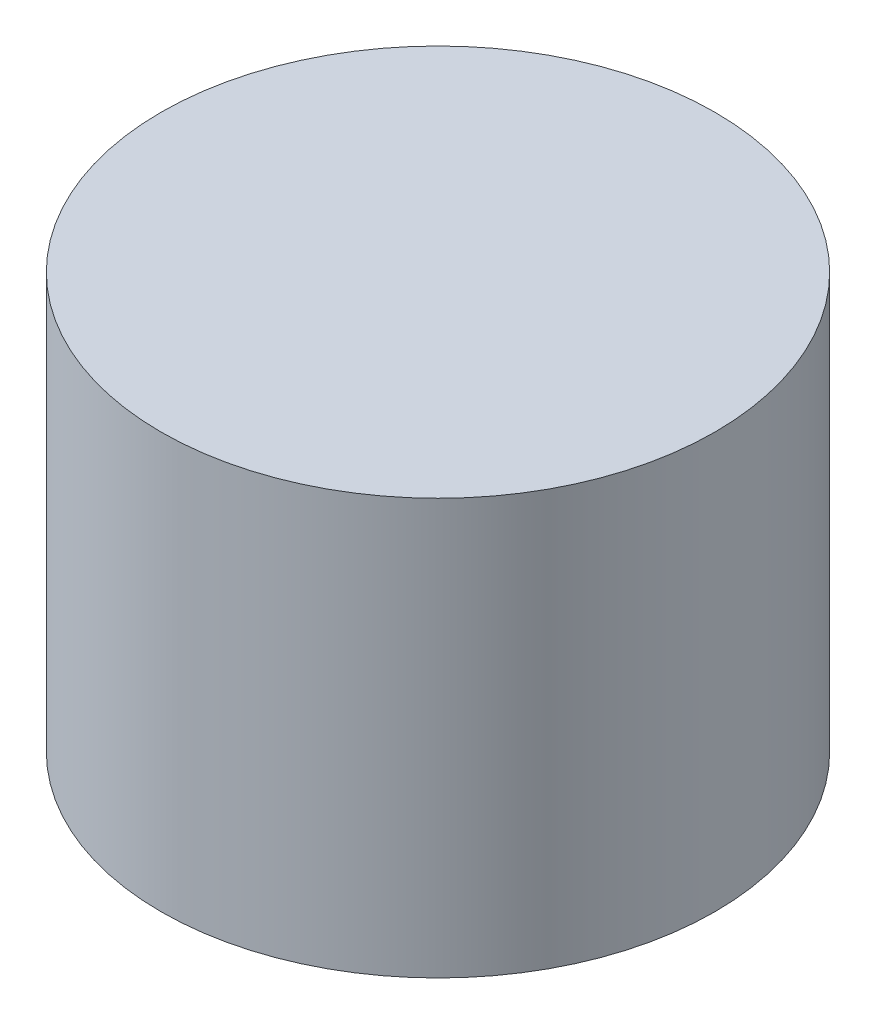
from build123d import *

# Parameters (mm, degrees)
SKETCH_2_R      = 10
EXTRUDE_1_DEPTH = 15


with BuildPart() as part:
    # 草图2 → 凸台-拉伸1 (new body)
    with BuildSketch(Plane(origin=(0, 0, 0), x_dir=(1, 0, 0), z_dir=(0, 1, 0))):
        with Locations(Location((0, 0, 0), (0, 0, 270))):
            Circle(SKETCH_2_R)
    extrude(amount=EXTRUDE_1_DEPTH)


solid = part.part
